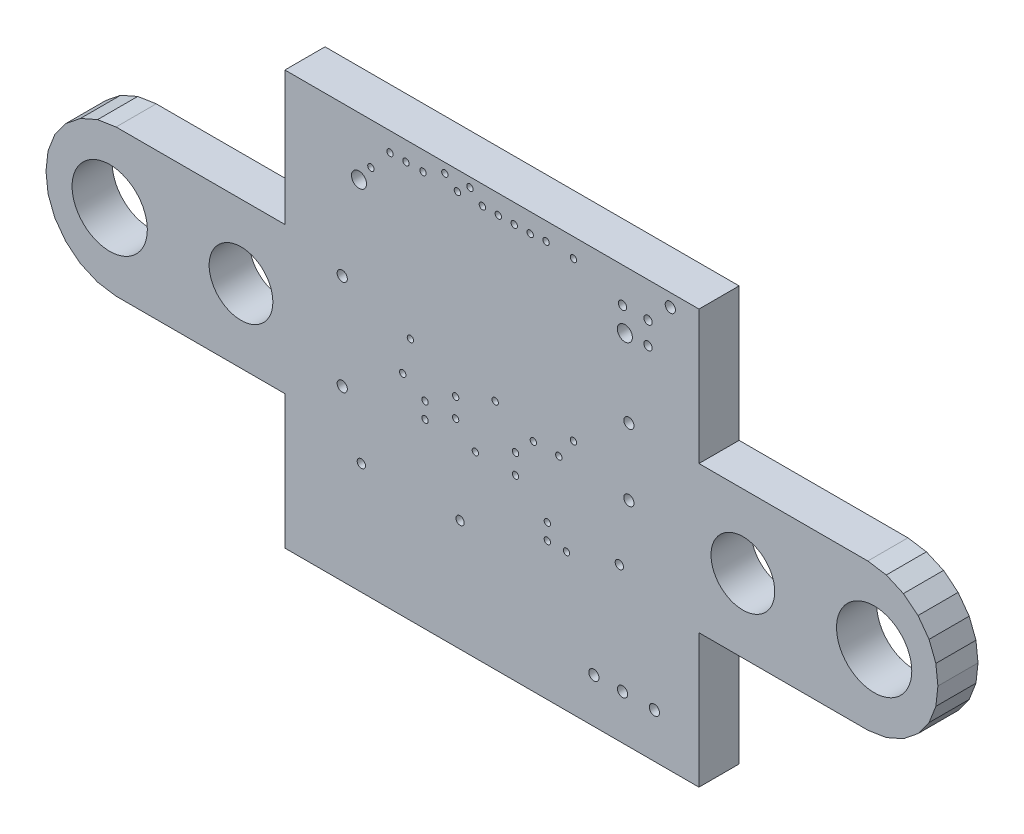
from build123d import *

# Parameters (mm, degrees)
BOARD_OUTLINE_DEPTH = 1.6
SKETCH2_R           = 0.3
SKETCH2_R_2         = 0.127
SKETCH2_R_3         = 0.1651
SKETCH2_R_4         = 0.2032
SKETCH2_R_5         = 1.5
NPTH_DEPTH          = 31.870071671
SKETCH3_R           = 1.27
PTH_DEPTH           = 31.870071671


with BuildPart() as part:
    # Sketch1 → Board_Outline (new body)
    with BuildSketch(Plane.XY):
        Polygon((0, 16.51), (0, 11.176), (-6.731, 11.176), (-7.468412, 11.062199), (-8.151243, 10.761418), (-8.732959, 10.294157), (-9.173918, 9.692258), (-9.444069, 8.996739), (-9.525, 8.255), (-9.444069, 7.513261), (-9.173918, 6.817742), (-8.732959, 6.215843), (-8.151243, 5.748582), (-7.468412, 5.447801), (-6.731, 5.334), (0, 5.334), (0, 0), (16.51, 0), (16.51, 5.334), (23.241, 5.334), (23.978412, 5.447801), (24.661243, 5.748582), (25.242959, 6.215843), (25.683918, 6.817742), (25.954069, 7.513261), (26.035, 8.255), (25.954069, 8.996739), (25.683918, 9.692258), (25.242959, 10.294157), (24.661243, 10.761418), (23.978412, 11.062199), (23.241, 11.176), (16.51, 11.176), (16.51, 16.51), align=None)
    extrude(amount=BOARD_OUTLINE_DEPTH)

    # Sketch2 → NPTH (cut, through all)
    with BuildSketch(Plane.XY):
        with Locations((13.555, 14.2)):
            Circle(SKETCH2_R)
        with Locations((2.955, 14.2)):
            Circle(SKETCH2_R)
        with Locations((9.1948, 7.8994)):
            Circle(SKETCH2_R_2)
        with Locations((10.4648, 5.4864)):
            Circle(SKETCH2_R_2)
        with Locations((11.2268, 5.4864)):
            Circle(SKETCH2_R_2)
        with Locations((10.4648, 6.1214)):
            Circle(SKETCH2_R_2)
        with Locations((10.414, 15.7988)):
            Circle(SKETCH2_R_2)
        with Locations((5.005, 9.727)):
            Circle(SKETCH2_R_2)
        with Locations((6.8072, 8.636)):
            Circle(SKETCH2_R_2)
        with Locations((4.699, 8.382)):
            Circle(SKETCH2_R_2)
        with Locations((10.922, 8.636)):
            Circle(SKETCH2_R_2)
        with Locations((6.378, 16.129)):
            Circle(SKETCH2_R_2)
        with Locations((6.8072, 7.874)):
            Circle(SKETCH2_R_2)
        with Locations((6.878, 15.748)):
            Circle(SKETCH2_R_2)
        with Locations((7.378, 16.141)):
            Circle(SKETCH2_R_2)
        with Locations((7.5946, 7.1186)):
            Circle(SKETCH2_R_2)
        with Locations((8.509, 15.748)):
            Circle(SKETCH2_R_2)
        with Locations((5.588, 7.239)):
            Circle(SKETCH2_R_2)
        with Locations((9.779, 15.748)):
            Circle(SKETCH2_R_2)
        with Locations((9.906, 8.636)):
            Circle(SKETCH2_R_2)
        with Locations((9.194, 7.112)):
            Circle(SKETCH2_R_2)
        with Locations((9.144, 15.748)):
            Circle(SKETCH2_R_2)
        with Locations((5.588, 7.874)):
            Circle(SKETCH2_R_2)
        with Locations((13.335, 6.096)):
            Circle(SKETCH2_R_3)
        with Locations((12.319, 1.778)):
            Circle(SKETCH2_R_4)
        with Locations((13.716, 8.509)):
            Circle(SKETCH2_R_4)
        with Locations((2.286, 6.731)):
            Circle(SKETCH2_R_4)
        with Locations((6.985, 4.445)):
            Circle(SKETCH2_R_3)
        with Locations((3.048, 4.445)):
            Circle(SKETCH2_R_3)
        with Locations((11.505, 9.45)):
            Circle(SKETCH2_R_2)
        with Locations((8.386, 9.267)):
            Circle(SKETCH2_R_2)
        with Locations((4.826, 15.748)):
            Circle(SKETCH2_R_2)
        with Locations((4.191, 15.748)):
            Circle(SKETCH2_R_2)
        with Locations((-6.985, 8.255)):
            Circle(SKETCH2_R_5)
        with Locations((23.495, 8.255)):
            Circle(SKETCH2_R_5)
        with Locations((13.716, 11.176)):
            Circle(SKETCH2_R_4)
        with Locations((2.286, 10.541)):
            Circle(SKETCH2_R_4)
        with Locations((14.478, 15.113)):
            Circle(SKETCH2_R_3)
        with Locations((13.462, 15.113)):
            Circle(SKETCH2_R_3)
        with Locations((14.478, 14.224)):
            Circle(SKETCH2_R_3)
        with Locations((5.505, 15.748)):
            Circle(SKETCH2_R_2)
        with Locations((3.429, 14.859)):
            Circle(SKETCH2_R_2)
        with Locations((7.874, 15.748)):
            Circle(SKETCH2_R_2)
        with Locations((11.5062, 15.748)):
            Circle(SKETCH2_R_2)
        with Locations((13.462, 1.778)):
            Circle(SKETCH2_R_4)
        with Locations((14.732, 1.778)):
            Circle(SKETCH2_R_4)
        with Locations((15.367, 16.002)):
            Circle(SKETCH2_R_4)
    extrude(amount=NPTH_DEPTH, mode=Mode.SUBTRACT)

    # Sketch3 → PTH (cut, through all)
    with BuildSketch(Plane.XY):
        with Locations((-1.75, 8.26)):
            Circle(SKETCH3_R)
        with Locations((18.26, 8.26)):
            Circle(SKETCH3_R)
    extrude(amount=PTH_DEPTH, mode=Mode.SUBTRACT)


solid = part.part
